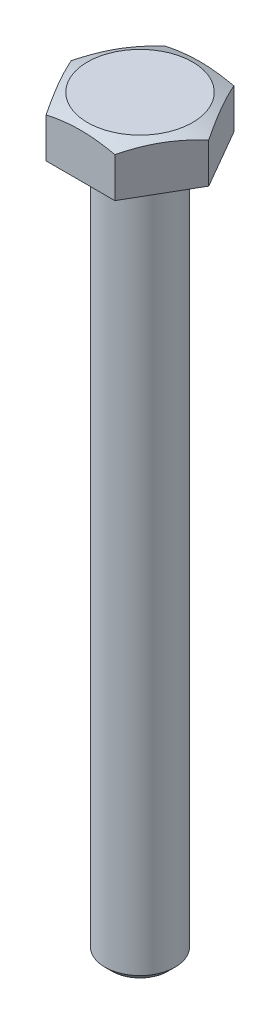
from build123d import *

# Parameters (mm, degrees)
EXTRUDE_1_DEPTH = 6.7
SKETCH_4_R      = 5
EXTRUDE_2_DEPTH = 100
CHAMFER_1_SIZE  = 1


with BuildPart() as part:
    # 草图2 → 凸台-拉伸1 (new body)
    with BuildSketch(Plane(origin=(0, 0, 0), x_dir=(1, 0, 0), z_dir=(0, 1, 0))):
        Polygon((9.814954576, 0), (4.907477288, 8.5), (-4.907477288, 8.5), (-9.814954576, 0), (-4.907477288, -8.5), (4.907477288, -8.5), align=None)
    extrude(amount=EXTRUDE_1_DEPTH)

    # 草图3 → 切除-旋转1 (revolve, cut)
    with BuildSketch(Plane.XY, mode=Mode.PRIVATE) as cut_revolve_1_sk:
        Polygon((-9.814954576, 5.7), (-7.5, 6.7), (-9.814954576, 6.7), align=None)
    revolve(cut_revolve_1_sk.sketch.rotate(Axis((0, 0, 0), (0, 1, 0)), 270), axis=Axis((0, 0, 0), (0, 1, 0)), mode=Mode.SUBTRACT)

    # 草图4 → 凸台-拉伸2 (add)
    with BuildSketch(Plane.XZ):
        with Locations(Location((0, 0, 0), (0, 0, 270))):
            Circle(SKETCH_4_R)
    extrude(amount=EXTRUDE_2_DEPTH)

    # 倒角1
    chamfer_1_edges = [part.edges().sort_by_distance(p)[0] for p in [
        (0, -100, 5),
    ]]
    chamfer(chamfer_1_edges, length=CHAMFER_1_SIZE)


solid = part.part
